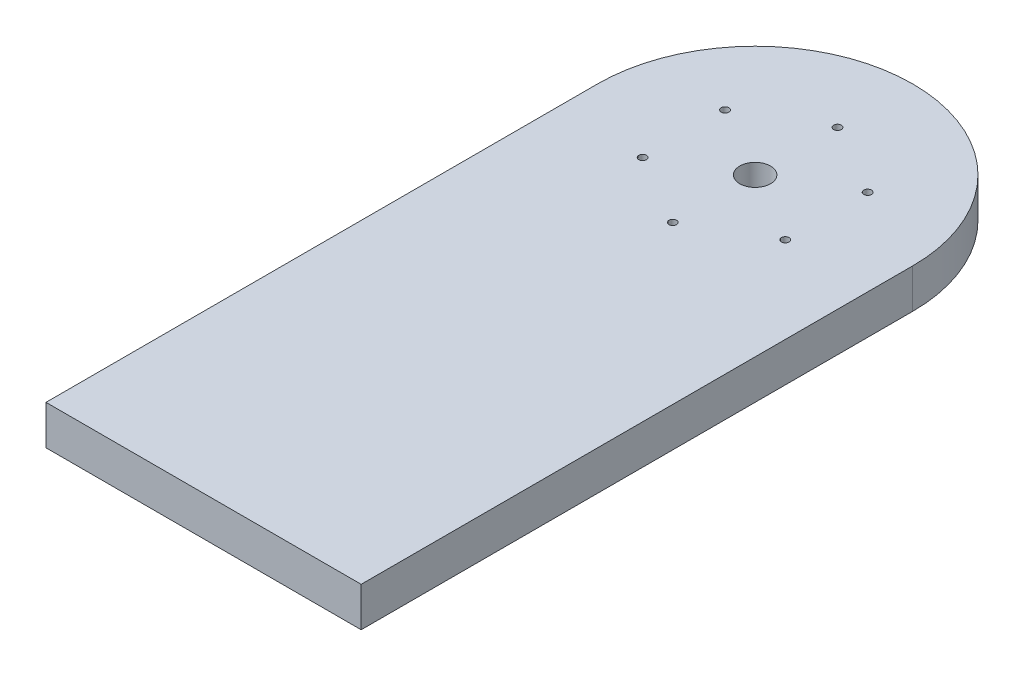
from build123d import *

# Parameters (mm, degrees)
BOSS_EXTRUDE1_DEPTH = 6.35
SKETCH2_R           = 0.62000003
CUT_EXTRUDE1_DEPTH  = 6.35
SKETCH3_R           = 2.480100005
CUT_EXTRUDE2_DEPTH  = 6.35


with BuildPart() as part:
    # Sketch1 → Boss-Extrude1 (new body)
    with BuildSketch(Plane(origin=(0, 0, 0), x_dir=(1, 0, 0), z_dir=(0, 1, 0))):
        with BuildLine():
            Line((-25.4, 0), (-25.4, -88.9))
            Line((-25.4, -88.9), (25.4, -88.9))
            Line((25.4, -88.9), (25.4, 0))
            ThreePointArc((25.4, 0), (0, 25.4), (-25.4, 0))
        make_face()
    extrude(amount=BOSS_EXTRUDE1_DEPTH)

    # Sketch2 → Cut-Extrude1 (cut)
    with BuildSketch(Plane(origin=(0, 6.35, 0), x_dir=(1, 0, 0), z_dir=(0, 1, 0))):
        with Locations(Location((0, 13.271000001, 0), (0, 0, 270))):
            Circle(SKETCH2_R)
        with Locations(Location((0, -13.271000001, 0), (0, 0, 270))):
            Circle(SKETCH2_R)
        with Locations(Location((-11.493023134, 6.635500001, 0), (0, 0, 270))):
            Circle(SKETCH2_R)
        with Locations(Location((-11.493023134, -6.635500001, 0), (0, 0, 270))):
            Circle(SKETCH2_R)
        with Locations(Location((11.493023134, 6.635500001, 0), (0, 0, 270))):
            Circle(SKETCH2_R)
        with Locations(Location((11.493023134, -6.635500001, 0), (0, 0, 270))):
            Circle(SKETCH2_R)
    extrude(amount=-CUT_EXTRUDE1_DEPTH, mode=Mode.SUBTRACT)

    # Sketch3 → Cut-Extrude2 (cut)
    with BuildSketch(Plane(origin=(0, 6.35, 0), x_dir=(1, 0, 0), z_dir=(0, 1, 0))):
        with Locations(Location((0, 0, 0), (0, 0, 270))):
            Circle(SKETCH3_R)
    extrude(amount=-CUT_EXTRUDE2_DEPTH, mode=Mode.SUBTRACT)


solid = part.part
